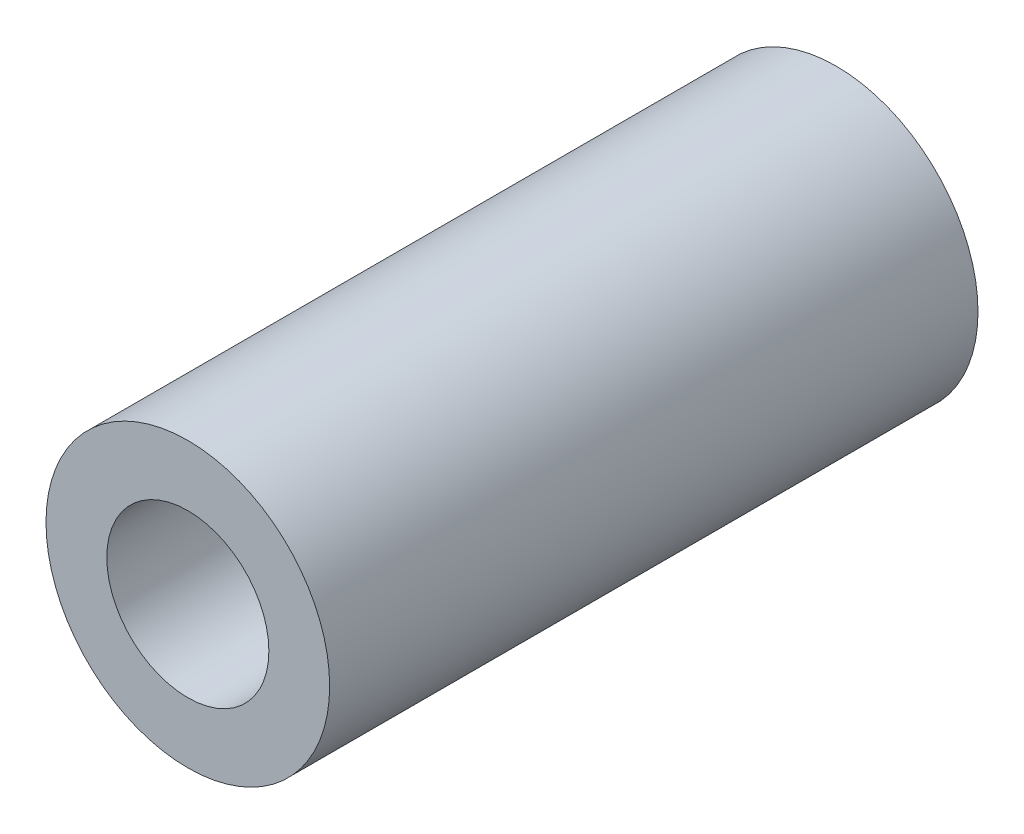
from build123d import *

# Parameters (mm, degrees)
SKETCH1_W = 3.999992
SKETCH1_H = 0.375


with BuildPart() as part:
    # Sketch1 → Revolve1 (revolve)
    with BuildSketch(Plane(origin=(0, 0, 0), x_dir=(0, 0, -1), z_dir=(1, 0, 0)), mode=Mode.PRIVATE) as revolve1_sk:
        with Locations((0, 1.422931235)):
            Rectangle(SKETCH1_W, SKETCH1_H)
    revolve(revolve1_sk.sketch.rotate(Axis((0, 0.735431235, 0), (0, 0, -1)), 90), axis=Axis((0, 0.735431235, 0), (0, 0, -1)))


solid = part.part
